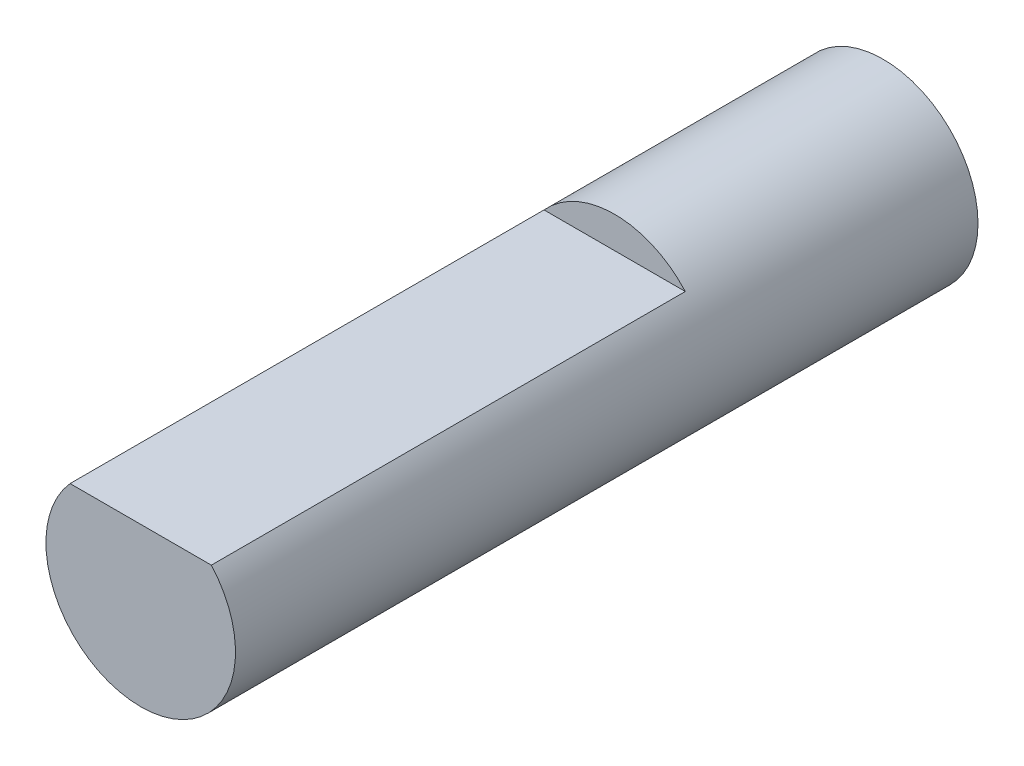
from build123d import *

# Parameters (mm, degrees)
SKETCH1_R           = 3.81
BOSS_EXTRUDE1_DEPTH = 29.845
CUT_EXTRUDE1_DEPTH  = 19.05


with BuildPart() as part:
    # Sketch1 → Boss-Extrude1 (new body)
    with BuildSketch(Plane.XY):
        with Locations(Location((0, 0, 0), (0, 0, 180))):
            Circle(SKETCH1_R)
    extrude(amount=BOSS_EXTRUDE1_DEPTH)

    # Sketch2 → Cut-Extrude1 (cut)
    with BuildSketch(Plane.XY.offset(29.845)):
        Polygon((-31.229197213, 2.54), (-2.839806331, 2.54), (2.839806331, 2.54), (31.229197213, 2.54), (31.229197213, 59.318781762), (-31.229197213, 59.318781762), align=None)
    extrude(amount=-CUT_EXTRUDE1_DEPTH, mode=Mode.SUBTRACT)


solid = part.part
